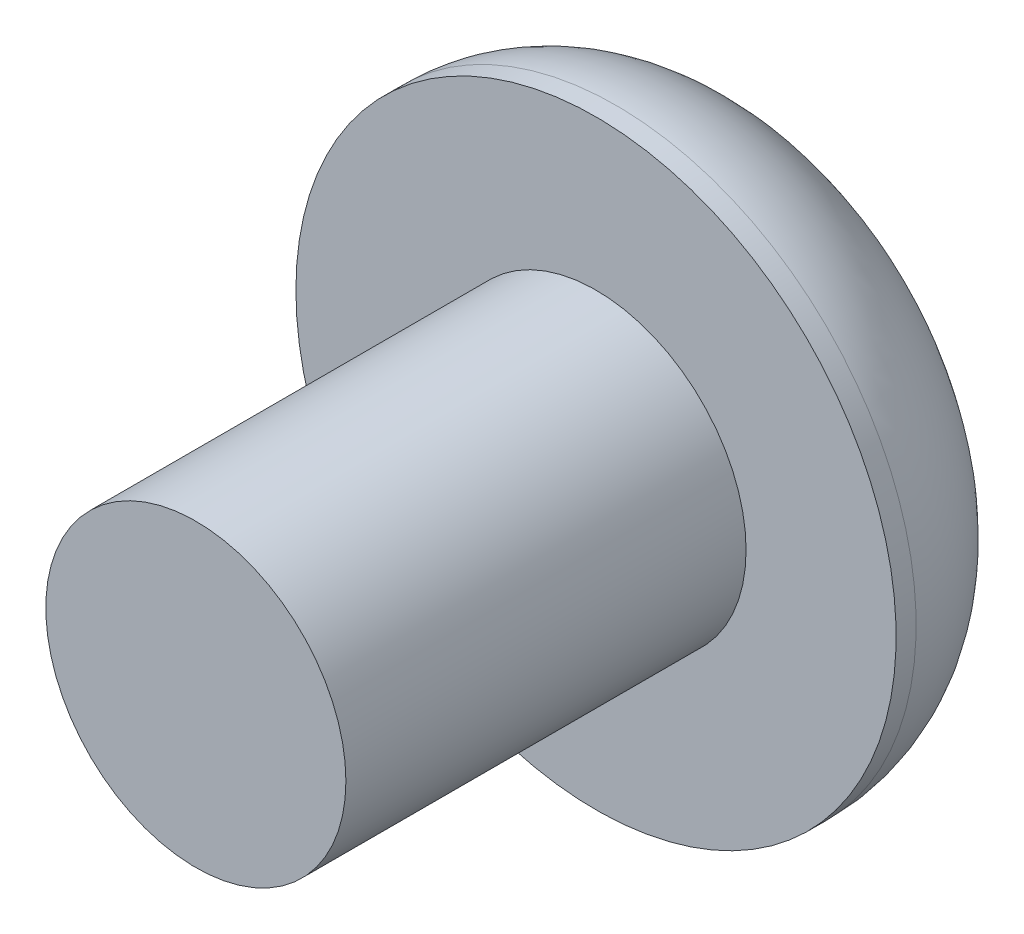
from build123d import *

# Parameters (mm, degrees)
SKETCH_1_R      = 1.5
EXTRUDE_1_DEPTH = 4
SKETCH_2_R      = 3
EXTRUDE_2_DEPTH = 1.7
FILLET_1_R      = 1.5


with BuildPart() as part:
    # Sketch 1 → 凸台-拉伸1 (new body)
    with BuildSketch(Plane.XY):
        Circle(SKETCH_1_R)
    extrude(amount=EXTRUDE_1_DEPTH)

    # 草图2 → 凸台-拉伸2 (add)
    with BuildSketch(Plane(origin=(0, 0, 0), x_dir=(-1, 0, 0), z_dir=(0, 0, -1))):
        Circle(SKETCH_2_R)
    extrude(amount=EXTRUDE_2_DEPTH)

    # 圆角1
    fillet_1_edges = [part.edges().sort_by_distance(p)[0] for p in [
        (3, 0, -1.7),
    ]]
    fillet(fillet_1_edges, radius=FILLET_1_R)


solid = part.part
